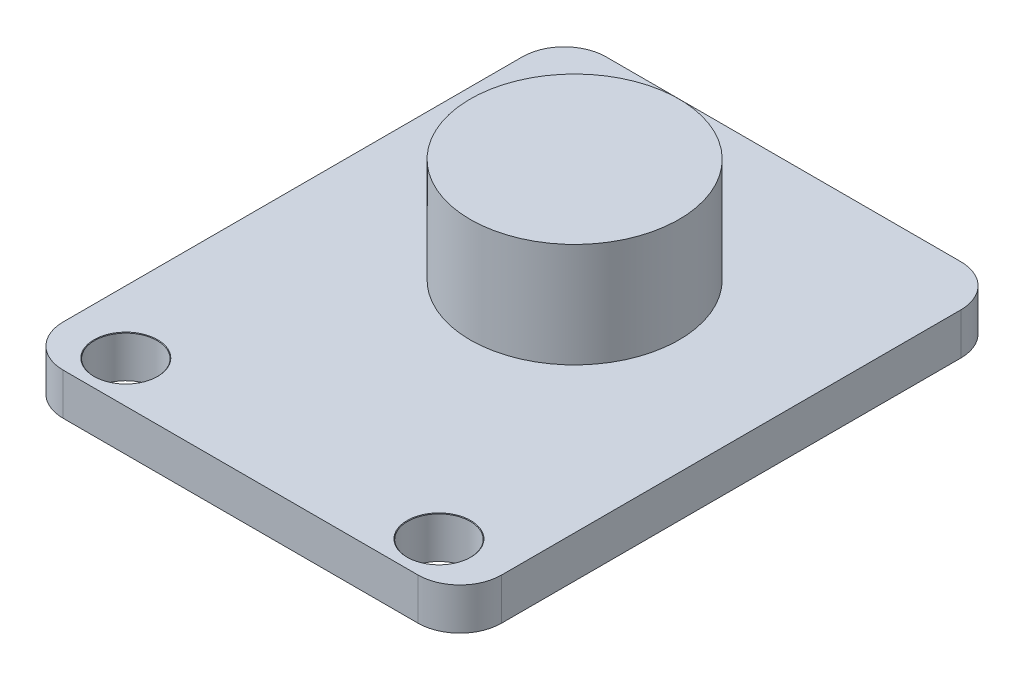
from build123d import *

# Parameters (mm, degrees)
SKETCH1_W                          = 21
SKETCH1_H                          = 26
BOSS_EXTRUDE1_DEPTH                = 2
FILLET1_R                          = 2
SKETCH2_R                          = 5
BOSS_EXTRUDE2_DEPTH                = 5
F_3_0_3_DIAMETER_HOLE1_D           = 3
F_3_0_3_DIAMETER_HOLE1_CSINK_D     = 3.05
F_3_0_3_DIAMETER_HOLE1_CSINK_ANGLE = 90


with BuildPart() as part:
    # Sketch1 → Boss-Extrude1 (new body)
    with BuildSketch(Plane(origin=(0, 0, 0), x_dir=(1, 0, 0), z_dir=(0, 1, 0))):
        Rectangle(SKETCH1_W, SKETCH1_H)
    extrude(amount=BOSS_EXTRUDE1_DEPTH)

    # Fillet1
    fillet1_edges = [part.edges().sort_by_distance(p)[0] for p in [
        (10.5, 1, 13),
        (-10.5, 1, 13),
        (-10.5, 1, -13),
        (10.5, 1, -13),
    ]]
    fillet(fillet1_edges, radius=FILLET1_R)

    # Sketch2 → Boss-Extrude2 (add)
    with BuildSketch(Plane(origin=(0, 2, 0), x_dir=(1, 0, 0), z_dir=(0, 1, 0))):
        with Locations(Location((0, 3, 0), (0, 0, 270))):
            Circle(SKETCH2_R)
    extrude(amount=BOSS_EXTRUDE2_DEPTH)

    # Ø3.0 (3) Diameter Hole1 (through all)
    with Locations(Plane(origin=(0, 2, 0), x_dir=(1, 0, 0), z_dir=(0, 1, 0))):
        with Locations((-7.5, -11), (7.5, -11)):
            CounterSinkHole(F_3_0_3_DIAMETER_HOLE1_D / 2, F_3_0_3_DIAMETER_HOLE1_CSINK_D / 2, counter_sink_angle=F_3_0_3_DIAMETER_HOLE1_CSINK_ANGLE)


solid = part.part
